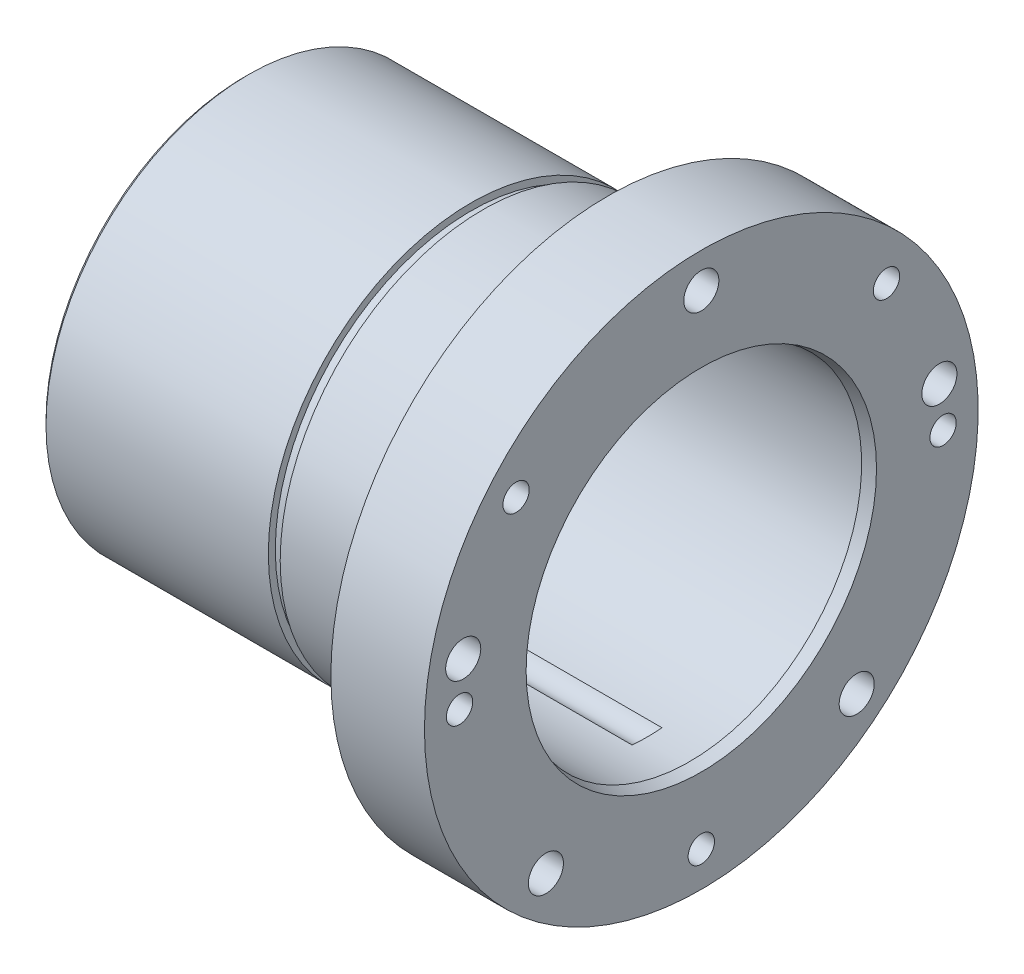
from build123d import *

# Parameters (mm, degrees)
CHAMFER1_SIZE      = 1.5875
CHAMFER2_SIZE      = 4.7752
CHAMFER2_SIZE2     = 1.279510984
SKETCH2_R          = 7.112
CUT_EXTRUDE1_DEPTH = 163.7284
SKETCH3_R          = 7.14375
CUT_EXTRUDE2_DEPTH = 218.327643362
CIRPATTERN1_COUNT  = 18
CIRPATTERN2_COUNT  = 36


with BuildPart() as part:
    # Sketch1 → Revolve1 (revolve)
    with BuildSketch(Plane.XY, mode=Mode.PRIVATE) as revolve1_sk:
        Polygon((0, 65.0875), (0, 82.54238), (92.1004, 82.54238), (92.1004, 79.7052), (96.9264, 79.7052), (96.9264, 82.54238), (147.7264, 82.54238), (147.7264, 112.7125), (185.8264, 112.7125), (185.8264, 70.04685), (19.05, 70.04685), (19.05, 65.0875), align=None)
    revolve(revolve1_sk.sketch.rotate(Axis((0, 0, 0), (1, 0, 0)), 90), axis=Axis((0, 0, 0), (1, 0, 0)))

    # Chamfer1
    chamfer1_edges = [part.edges().sort_by_distance(p)[0] for p in [
        (0, 0, -82.54238),
    ]]
    chamfer(chamfer1_edges, length=CHAMFER1_SIZE)

    # Chamfer2
    chamfer2_edges = [part.edges().sort_by_distance(p)[0] for p in [
        (185.8264, 0, -70.04685),
    ]]
    chamfer2_side = [part.faces().sort_by_distance(p)[0] for p in [
        (102.4382, 0, -70.04685),
    ]]
    chamfer(chamfer2_edges, length=CHAMFER2_SIZE, length2=CHAMFER2_SIZE2, reference=chamfer2_side[0])

    # Sketch2 → Cut-Extrude1 (cut)
    with BuildSketch(Plane.ZY):
        with Locations((0, -66.10985)):
            Circle(SKETCH2_R)
    extrude(amount=-CUT_EXTRUDE1_DEPTH, mode=Mode.SUBTRACT)

    # Sketch3 → Cut-Extrude2 (cut, through all)
    with BuildSketch(Plane.ZY.offset(-147.7264)):
        with Locations((0, 98.425)):
            Circle(SKETCH3_R)
    cut_extrude2 = extrude(amount=-CUT_EXTRUDE2_DEPTH, mode=Mode.SUBTRACT)

    # CirPattern1: Cut-Extrude2 ×18 about axis, 13 skipped
    cirpattern1_axis = Axis((147.7264, 0, 0), (-1, 0, 0))
    add([cut_extrude2.rotate(cirpattern1_axis, i * 360 / CIRPATTERN1_COUNT) for i in range(1, CIRPATTERN1_COUNT) if i not in (1, 2, 3, 5, 6, 8, 9, 10, 12, 13, 15, 16, 17)], mode=Mode.SUBTRACT)

    # Sketch5 → Tap Drill for 1/2-13 Tap1 (revolve, cut)
    with BuildSketch(Plane(origin=(147.7264, -98.425, 0), x_dir=(0, 0, 1), z_dir=(0, 1, 0))):
        Polygon((0, 0), (0, 41.319489309), (5.35813, 38.1), (5.35813, 0.532828266), (5.99313, 0), align=None)
    tap_drill_for_1_2_13_tap1 = revolve(axis=Axis((141.3764, -98.425, 0), (1, 0, 0)), mode=Mode.SUBTRACT)

    # CirPattern2: Tap Drill for 1/2-13 Tap1 ×36 about axis, 31 skipped
    cirpattern2_axis = Axis((147.7264, 0, 0), (-1, 0, 0))
    add([tap_drill_for_1_2_13_tap1.rotate(cirpattern2_axis, i * 360 / CIRPATTERN2_COUNT) for i in range(1, CIRPATTERN2_COUNT) if i not in (1, 2, 3, 4, 5, 6, 7, 8, 10, 11, 12, 14, 15, 16, 17, 18, 19, 20, 21, 22, 24, 25, 26, 28, 29, 30, 31, 32, 33, 34, 35)], mode=Mode.SUBTRACT)


solid = part.part
